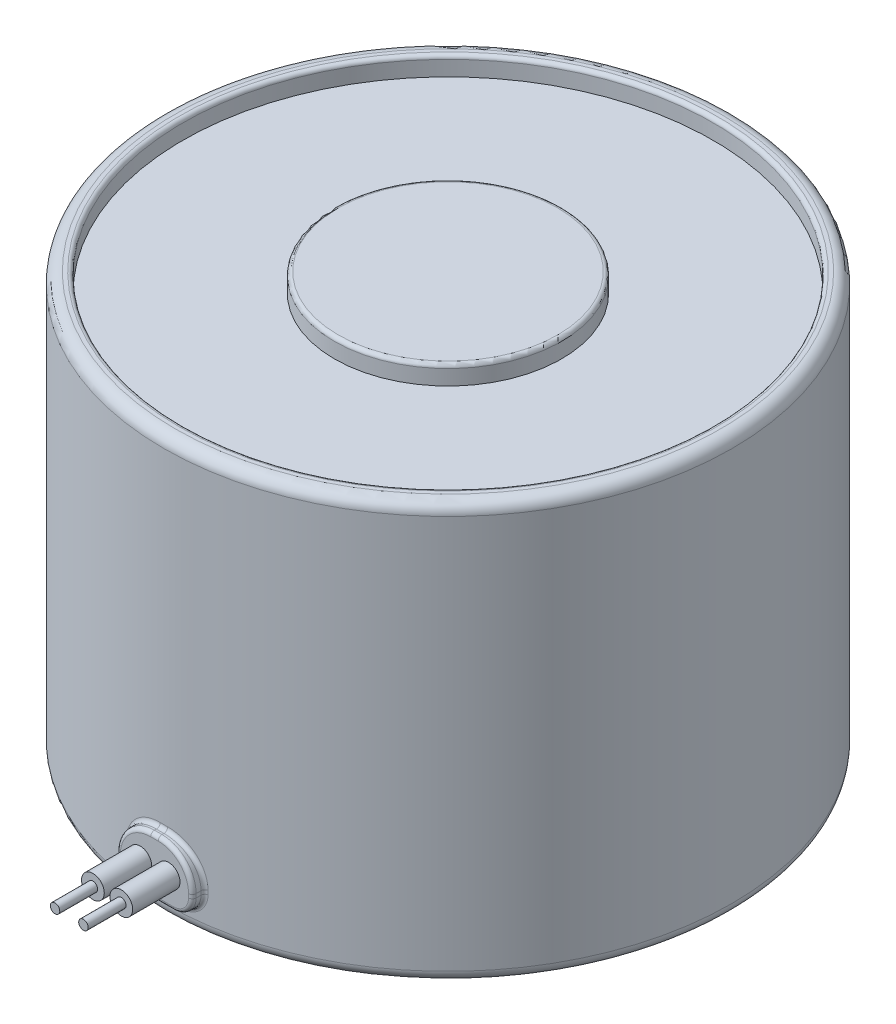
from build123d import *

# Parameters (mm, degrees)
SKETCH1_R                            = 15
BOSS_EXTRUDE1_DEPTH                  = 22
SKETCH2_R                            = 14
SKETCH2_R_2                          = 6
CUT_EXTRUDE1_DEPTH                   = 1
M4_TAPPED_HOLE1_D                    = 3.3
M4_TAPPED_HOLE1_DEPTH                = 6
M4_TAPPED_HOLE1_CSINK_D              = 4.5
M4_TAPPED_HOLE1_CSINK_ANGLE          = 90
M4_TAPPED_HOLE1_TIP                  = 0.952627944
BOSS_EXTRUDE2_DEPTH                  = 0.5
BOSS_EXTRUDE2_DIRECTION_2_REACH      = 42.112
BOSS_EXTRUDE2_DIRECTION_2_END_RADIUS = 15
SKETCH9_R                            = 0.6
BOSS_EXTRUDE3_DEPTH                  = 3
SKETCH10_R                           = 0.25
BOSS_EXTRUDE4_DEPTH                  = 5
FILLET1_R                            = 0.6
FILLET2_R                            = 0.2
FILLET3_R                            = 0.2
FILLET4_R                            = 0.2


with BuildPart() as part:
    # Sketch1 → Boss-Extrude1 (new body)
    with BuildSketch(Plane(origin=(0, 0, 0), x_dir=(1, 0, 0), z_dir=(0, 1, 0))):
        with Locations(Location((0, 0, 0), (0, 0, 270))):
            Circle(SKETCH1_R)
    extrude(amount=BOSS_EXTRUDE1_DEPTH)

    # Sketch2 → Cut-Extrude1 (cut)
    with BuildSketch(Plane(origin=(0, 22, 0), x_dir=(1, 0, 0), z_dir=(0, 1, 0))):
        with Locations(Location((0, 0, 0), (0, 0, 270))):
            Circle(SKETCH2_R)
        with Locations(Location((0, 0, 0), (0, 0, 270))):
            Circle(SKETCH2_R_2, mode=Mode.SUBTRACT)
    extrude(amount=-CUT_EXTRUDE1_DEPTH, mode=Mode.SUBTRACT)

    # M4 Tapped Hole1
    with Locations(Plane(origin=(0, 0, 0), x_dir=(-1, 0, 0), z_dir=(0, -1, 0))):
        with Locations((0, 0)):
            CounterSinkHole(M4_TAPPED_HOLE1_D / 2, M4_TAPPED_HOLE1_CSINK_D / 2, depth=M4_TAPPED_HOLE1_DEPTH, counter_sink_angle=M4_TAPPED_HOLE1_CSINK_ANGLE)
            with Locations((0, 0, -(M4_TAPPED_HOLE1_DEPTH + M4_TAPPED_HOLE1_TIP / 2))):  # 120° drill point
                Cone(0, M4_TAPPED_HOLE1_D / 2, M4_TAPPED_HOLE1_TIP, mode=Mode.SUBTRACT)

    # Sketch8 → Boss-Extrude2 (add)
    with BuildSketch(Plane.XY.offset(15)):
        with BuildLine():
            Line((-0.2, 4), (0.2, 4))
            ThreePointArc((0.2, 4), (1.472792206, 3.472792206), (2, 2.2))
            Line((2, 2.2), (2, 2))
            ThreePointArc((2, 2), (1.707106781, 1.292893219), (1, 1))
            Line((1, 1), (-1, 1))
            ThreePointArc((-1, 1), (-1.707106781, 1.292893219), (-2, 2))
            Line((-2, 2), (-2, 2.2))
            ThreePointArc((-2, 2.2), (-1.472792206, 3.472792206), (-0.2, 4))
        make_face()
    extrude(amount=BOSS_EXTRUDE2_DEPTH)

    # Boss-Extrude2 direction 2: up to this cylinder (the profile starts outside it)
    boss_extrude2_direction_2_end = Plane(origin=(0, 2.403845, 0), z_dir=(0, -1, 0)) * Cylinder(BOSS_EXTRUDE2_DIRECTION_2_END_RADIUS, 115.224, mode=Mode.PRIVATE)
    # Sketch8 → Boss-Extrude2 direction 2 (add, up to the surface)
    with BuildSketch(Plane.XY.offset(15), mode=Mode.PRIVATE) as boss_extrude2_direction_2_sk1:
        with BuildLine():
            Line((-0.2, 4), (0.2, 4))
            ThreePointArc((0.2, 4), (1.472792206, 3.472792206), (2, 2.2))
            Line((2, 2.2), (2, 2))
            ThreePointArc((2, 2), (1.707106781, 1.292893219), (1, 1))
            Line((1, 1), (-1, 1))
            ThreePointArc((-1, 1), (-1.707106781, 1.292893219), (-2, 2))
            Line((-2, 2), (-2, 2.2))
            ThreePointArc((-2, 2.2), (-1.472792206, 3.472792206), (-0.2, 4))
        make_face()
    boss_extrude2_direction_2_tool1 = extrude(boss_extrude2_direction_2_sk1.sketch, amount=-BOSS_EXTRUDE2_DIRECTION_2_REACH, mode=Mode.PRIVATE) - boss_extrude2_direction_2_end
    add(boss_extrude2_direction_2_tool1.solids().sort_by_distance((0, 2.403845, 15))[0])
    add(boss_extrude2_direction_2_tool1.solids().sort_by_distance((0, 2.403845, 15))[1])

    # Sketch9 → Boss-Extrude3 (add)
    with BuildSketch(Plane.XY.offset(15)):
        with Locations((-0.75, 2.5)):
            Circle(SKETCH9_R)
        with Locations(Location((0.75, 2.5, 0), (0, 0, 180))):
            Circle(SKETCH9_R)
    extrude(amount=BOSS_EXTRUDE3_DEPTH)

    # Sketch10 → Boss-Extrude4 (add)
    with BuildSketch(Plane.XY.offset(15)):
        with Locations((-0.75, 2.5)):
            Circle(SKETCH10_R)
        with Locations(Location((0.75, 2.5, 0), (0, 0, 180))):
            Circle(SKETCH10_R)
    extrude(amount=BOSS_EXTRUDE4_DEPTH)

    # Fillet1
    fillet1_edges = [part.edges().sort_by_distance(p)[0] for p in [
        (0, 0, -15),
        (0, 22, -15),
    ]]
    fillet(fillet1_edges, radius=FILLET1_R)

    # Fillet2
    fillet2_edges = [part.edges().sort_by_distance(p)[0] for p in [
        (1.706560762, 1.292347605, 14.902605487),
        (2, 2.1, 14.866068747),
        (1.472668664, 3.472915736, 14.927533186),
        (0.100002222, 4, 14.999666648),
        (-1.47266868, 3.472915752, 14.927533181),
        (-2, 2.1, 14.866068747),
        (-1.706560762, 1.292347605, 14.902605487),
        (0.500278319, 1, 14.991655066),
        (1.707106781, 1.292893219, 15.5),
        (2, 2.1, 15.5),
        (1.472792206, 3.472792206, 15.5),
        (0, 4, 15.5),
        (-1.472792206, 3.472792206, 15.5),
        (-2, 2.1, 15.5),
        (-1.707106781, 1.292893219, 15.5),
        (0, 1, 15.5),
    ]]
    fillet(fillet2_edges, radius=FILLET2_R)

    # Fillet3
    fillet3_edges = [part.edges().sort_by_distance(p)[0] for p in [
        (0, 22, -6),
    ]]
    fillet(fillet3_edges, radius=FILLET3_R)

    # Fillet4
    fillet4_edges = [part.edges().sort_by_distance(p)[0] for p in [
        (0, 22, -14),
    ]]
    fillet(fillet4_edges, radius=FILLET4_R)


solid = part.part
